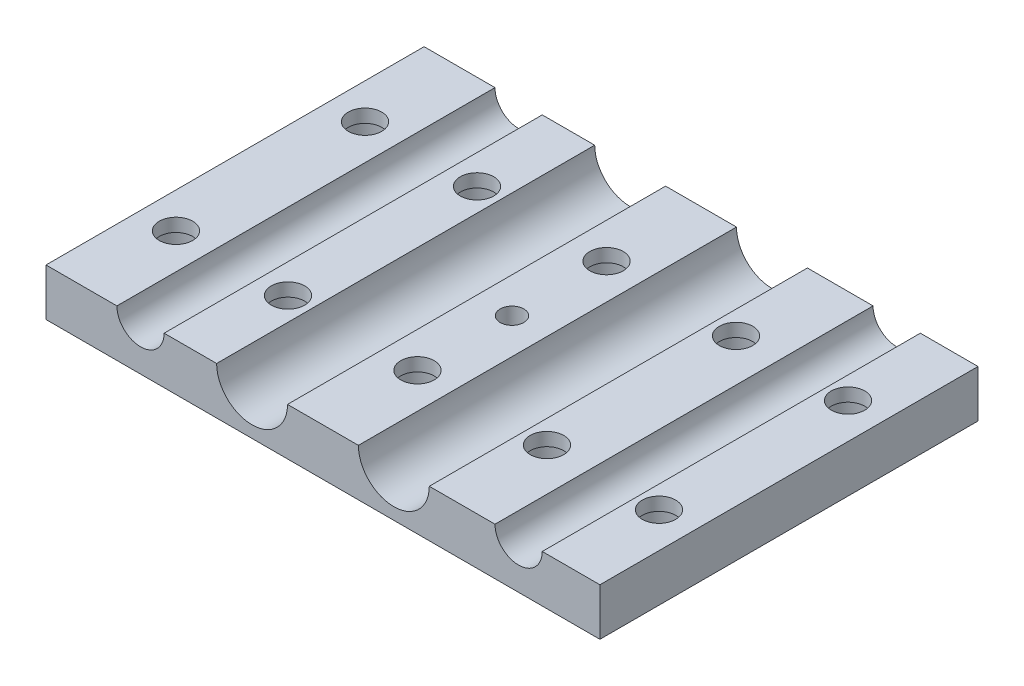
from build123d import *

# Parameters (mm, degrees)
SKETCH1_W             = 74.422
SKETCH1_H             = 50.8
BOSS_EXTRUDE1_DEPTH   = 6.35
SKETCH2_R             = 3.175
CUT_EXTRUDE1_DEPTH    = 64.289975675
SKETCH3_R             = 4.7625
CUT_EXTRUDE2_DEPTH    = 64.289975675
F_8_CLEARANCE_HOLE1_D = 4.4958
SKETCH6_R             = 3.429
CUT_EXTRUDE3_DEPTH    = 4.572
SKETCH7_R             = 1.5875
CUT_EXTRUDE4_DEPTH    = 46.498802413
BODY_MOVE_COPY3_ANGLE = 180


with BuildPart() as part:
    # Sketch1 → Boss-Extrude1 (new body)
    with BuildSketch(Plane(origin=(0, 0, 0), x_dir=(1, 0, 0), z_dir=(0, 1, 0))):
        Rectangle(SKETCH1_W, SKETCH1_H)
    extrude(amount=BOSS_EXTRUDE1_DEPTH)

    # Sketch2 → Cut-Extrude1 (cut, through all)
    with BuildSketch(Plane.XY.offset(25.4)):
        with Locations((-24.511, 0)):
            Circle(SKETCH2_R)
        with Locations((26.289, 0)):
            Circle(SKETCH2_R)
    extrude(amount=-CUT_EXTRUDE1_DEPTH, mode=Mode.SUBTRACT)

    # Sketch3 → Cut-Extrude2 (cut, through all)
    with BuildSketch(Plane.XY.offset(25.4)):
        with Locations((-9.525, 0)):
            Circle(SKETCH3_R)
        with Locations((9.525, 0)):
            Circle(SKETCH3_R)
    extrude(amount=-CUT_EXTRUDE2_DEPTH, mode=Mode.SUBTRACT)

    # #8 Clearance Hole1 (through all)
    with Locations(Plane(origin=(0, 6.35, 0), x_dir=(1, 0, 0), z_dir=(0, 1, 0))):
        with Locations((-32.4485, 12.7), (-32.4485, -12.7), (-17.399, -12.7), (0, -12.7), (17.399, -12.7), (32.4485, -12.7), (32.4485, 12.7), (17.399, 12.7), (0, 12.7), (-17.399, 12.7)):
            Hole(F_8_CLEARANCE_HOLE1_D / 2)

    # Sketch6 → Cut-Extrude3 (cut)
    with BuildSketch(Plane(origin=(0, 6.35, 0), x_dir=(1, 0, 0), z_dir=(0, 1, 0))):
        with Locations(Location((-32.4485, 12.7, 0), (0, 0, 270))):
            Circle(SKETCH6_R)
        with Locations(Location((-17.399, 12.7, 0), (0, 0, 270))):
            Circle(SKETCH6_R)
        with Locations(Location((0, 12.7, 0), (0, 0, 270))):
            Circle(SKETCH6_R)
        with Locations(Location((17.399, 12.7, 0), (0, 0, 270))):
            Circle(SKETCH6_R)
        with Locations(Location((32.4485, 12.7, 0), (0, 0, 270))):
            Circle(SKETCH6_R)
        with Locations(Location((32.4485, -12.7, 0), (0, 0, 270))):
            Circle(SKETCH6_R)
        with Locations(Location((17.399, -12.7, 0), (0, 0, 270))):
            Circle(SKETCH6_R)
        with Locations(Location((0, -12.7, 0), (0, 0, 270))):
            Circle(SKETCH6_R)
        with Locations(Location((-17.399, -12.7, 0), (0, 0, 270))):
            Circle(SKETCH6_R)
        with Locations(Location((-32.4485, -12.7, 0), (0, 0, 270))):
            Circle(SKETCH6_R)
    extrude(amount=-CUT_EXTRUDE3_DEPTH, mode=Mode.SUBTRACT)

    # Sketch7 → Cut-Extrude4 (cut, through all)
    with BuildSketch(Plane(origin=(0, 6.35, 0), x_dir=(1, 0, 0), z_dir=(0, 1, 0))):
        with Locations(Location((0, 0, 0), (0, 0, 270))):
            Circle(SKETCH7_R)
    extrude(amount=-CUT_EXTRUDE4_DEPTH, mode=Mode.SUBTRACT)


with BuildPart() as part_1:
    # Body-Move/Copy3: moved
    add(part.part.moved(Location((0, 0, 0))).rotate(Axis((0, 3.175, 0), (1, 0, 0)), BODY_MOVE_COPY3_ANGLE))


solid = part_1.part
